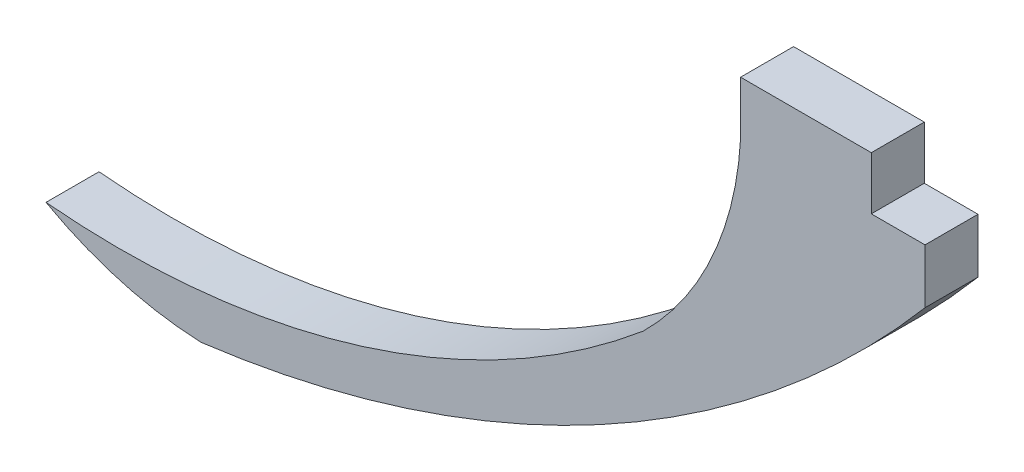
from build123d import *

# Parameters (mm, degrees)
BOSS_EXTRUDE1_DEPTH = 1.524


with BuildPart() as part:
    # Sketch1 → Boss-Extrude1 (new body)
    with BuildSketch(Plane.XY):
        with BuildLine():
            Line((1.507959842, 1.524), (1.507959842, 0))
            Line((1.507959842, 0), (3.052407177, 0))
            Line((3.052407177, 0), (3.052407177, -1.566256329))
            ThreePointArc((3.052407177, -1.566256329), (-6.301435783, -9.155076444), (-17.769362765, -12.838990069))
            ThreePointArc((-17.769362765, -12.838990069), (-20.072635935, -12.471877617), (-22.228452392, -11.581768494))
            ThreePointArc((-22.228452392, -11.581768494), (-13.1022498, -10.612386305), (-5.053668942, -6.202440528))
            ThreePointArc((-5.053668942, -6.202440528), (-3.071218913, -3.363942956), (-2.252033724, 0))
            Line((-2.252033724, 0), (-2.252033724, 1.524))
            Line((-2.252033724, 1.524), (1.507959842, 1.524))
        make_face()
    extrude(amount=BOSS_EXTRUDE1_DEPTH)


solid = part.part
